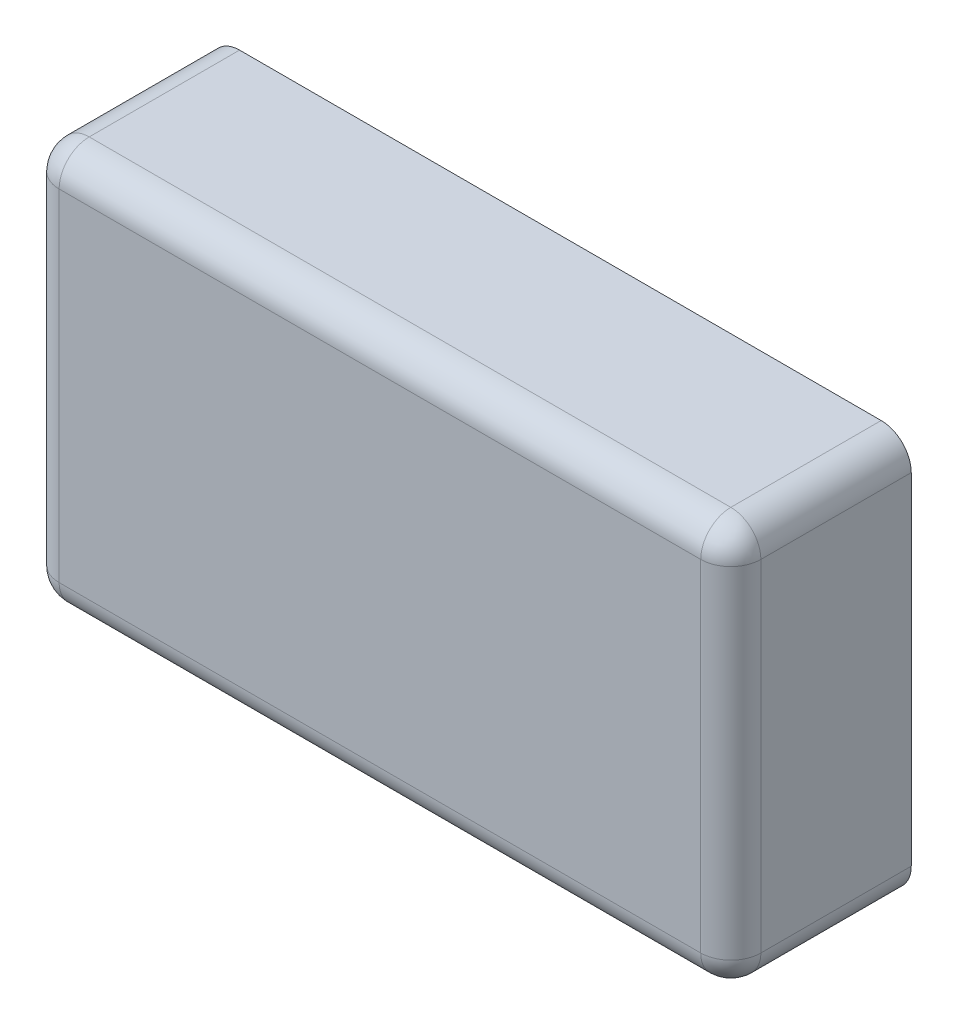
from build123d import *

# Parameters (mm, degrees)
SKETCH1_W           = 70
SKETCH1_H           = 40
BOSS_EXTRUDE1_DEPTH = 18
FILLET1_R           = 3


with BuildPart() as part:
    # Sketch1 → Boss-Extrude1 (new body)
    with BuildSketch(Plane.XY):
        with Locations((-45.340234895, 56.5)):
            Rectangle(SKETCH1_W, SKETCH1_H)
    extrude(amount=BOSS_EXTRUDE1_DEPTH)

    # Fillet1
    fillet1_edges = [part.edges().sort_by_distance(p)[0] for p in [
        (-80.340234895, 56.5, 18),
        (-45.340234895, 36.5, 18),
        (-10.340234895, 56.5, 18),
        (-10.340234895, 36.5, 9),
        (-80.340234895, 36.5, 9),
        (-80.340234895, 76.5, 9),
        (-10.340234895, 76.5, 9),
        (-45.340234895, 76.5, 18),
    ]]
    fillet(fillet1_edges, radius=FILLET1_R)


solid = part.part
